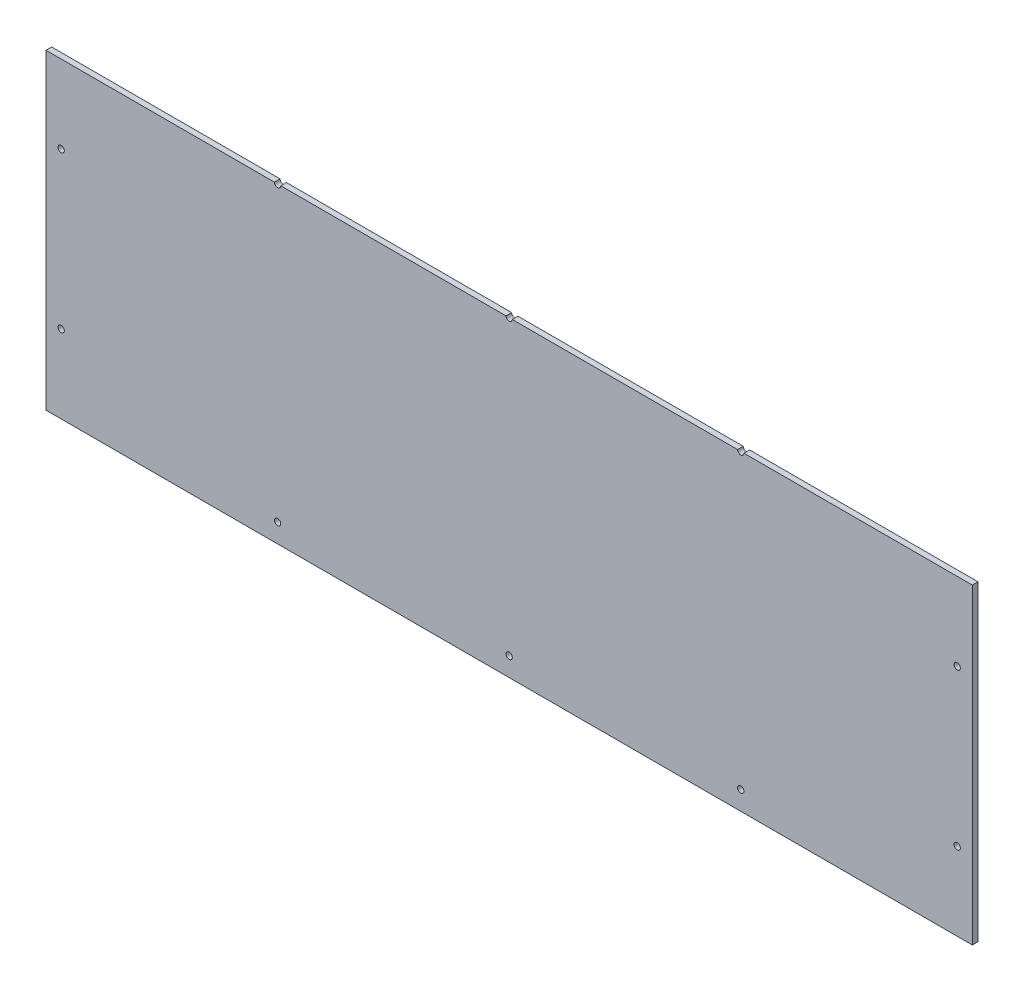
from build123d import *

# Parameters (mm, degrees)
SKETCH1_R           = 2.5
BOSS_EXTRUDE1_DEPTH = 4.5


with BuildPart() as part:
    # Sketch1 → Boss-Extrude1 (new body)
    with BuildSketch(Plane.XY):
        with BuildLine():
            Line((-367, 123.5), (-186, 123.5))
            ThreePointArc((-186, 123.5), (-183.5, 121), (-181, 123.5))
            Line((-181, 123.5), (-2.5, 123.5))
            ThreePointArc((-2.5, 123.5), (0, 121), (2.5, 123.5))
            Line((2.5, 123.5), (181, 123.5))
            ThreePointArc((181, 123.5), (183.5, 121), (186, 123.5))
            Line((186, 123.5), (367, 123.5))
            Line((367, 123.5), (367, -123.5))
            Line((367, -123.5), (-367, -123.5))
            Line((-367, -123.5), (-367, 123.5))
        make_face()
        with Locations((-355, 61.75)):
            Circle(SKETCH1_R, mode=Mode.SUBTRACT)
        with Locations((-355, -61.75)):
            Circle(SKETCH1_R, mode=Mode.SUBTRACT)
        with Locations(Location((355, -61.75, 0), (0, 0, 180))):
            Circle(SKETCH1_R, mode=Mode.SUBTRACT)
        with Locations(Location((355, 61.75, 0), (0, 0, 180))):
            Circle(SKETCH1_R, mode=Mode.SUBTRACT)
        with Locations((-183.5, -108.5)):
            Circle(SKETCH1_R, mode=Mode.SUBTRACT)
        with Locations((0, -108.5)):
            Circle(SKETCH1_R, mode=Mode.SUBTRACT)
        with Locations((183.5, -108.5)):
            Circle(SKETCH1_R, mode=Mode.SUBTRACT)
    extrude(amount=BOSS_EXTRUDE1_DEPTH)


solid = part.part
